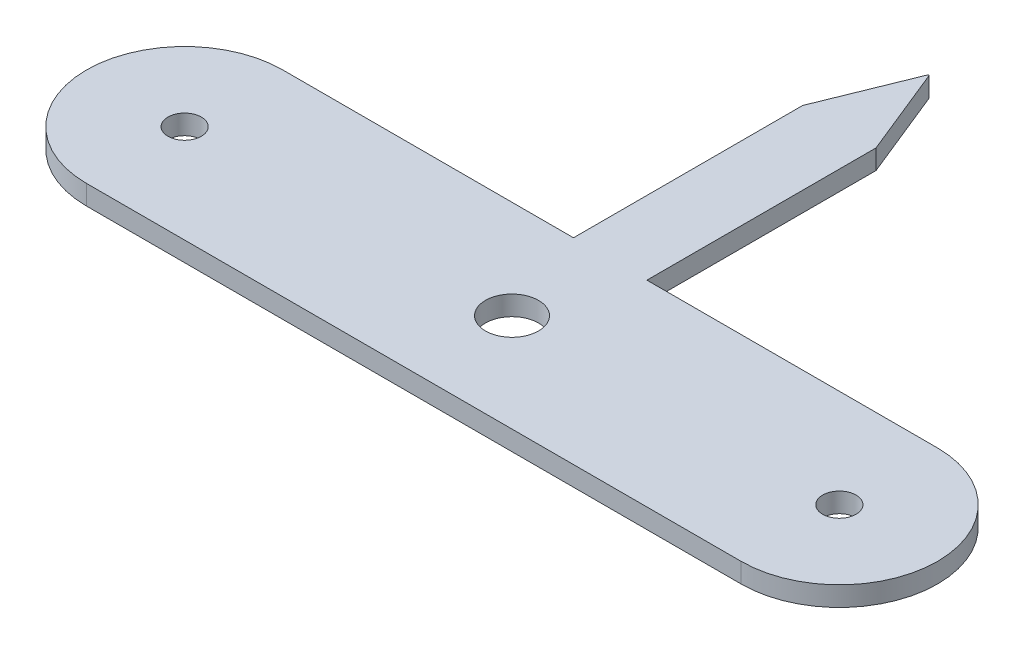
from build123d import *

# Parameters (mm, degrees)
BOSS_EXTRUDE1_DEPTH = 3
SKETCH2_R           = 4.05
SKETCH2_R_2         = 2.55
CUT_EXTRUDE1_DEPTH  = 3
FILLET1_R           = 0.1


with BuildPart() as part:
    # Sketch1 → Boss-Extrude1 (new body)
    with BuildSketch(Plane(origin=(0, 0, 0), x_dir=(1, 0, 0), z_dir=(0, 1, 0))):
        with BuildLine():
            Line((50, -15), (-50, -15))
            ThreePointArc((-50, -15), (-65, 0), (-50, 15))
            Line((-50, 15), (-5.606634193, 15))
            Line((-5.606634193, 15), (-5.606634193, 50))
            Line((-5.606634193, 50), (0, 63.840242005))
            Line((0, 63.840242005), (5.606634193, 50))
            Line((5.606634193, 50), (5.606634193, 15))
            Line((5.606634193, 15), (50, 15))
            ThreePointArc((50, 15), (65, 0), (50, -15))
        make_face()
    extrude(amount=BOSS_EXTRUDE1_DEPTH)

    # Sketch2 → Cut-Extrude1 (cut)
    with BuildSketch(Plane(origin=(0, 3, 0), x_dir=(1, 0, 0), z_dir=(0, 1, 0))):
        with Locations(Location((0, 0, 0), (0, 0, 270))):
            Circle(SKETCH2_R)
        with Locations(Location((-50, 0, 0), (0, 0, 270))):
            Circle(SKETCH2_R_2)
        with Locations(Location((50, 0, 0), (0, 0, 90))):
            Circle(SKETCH2_R_2)
    extrude(amount=-CUT_EXTRUDE1_DEPTH, mode=Mode.SUBTRACT)

    # Fillet1
    fillet1_edges = [part.edges().sort_by_distance(p)[0] for p in [
        (0, 1.5, -63.840242005),
    ]]
    fillet(fillet1_edges, radius=FILLET1_R)


solid = part.part
